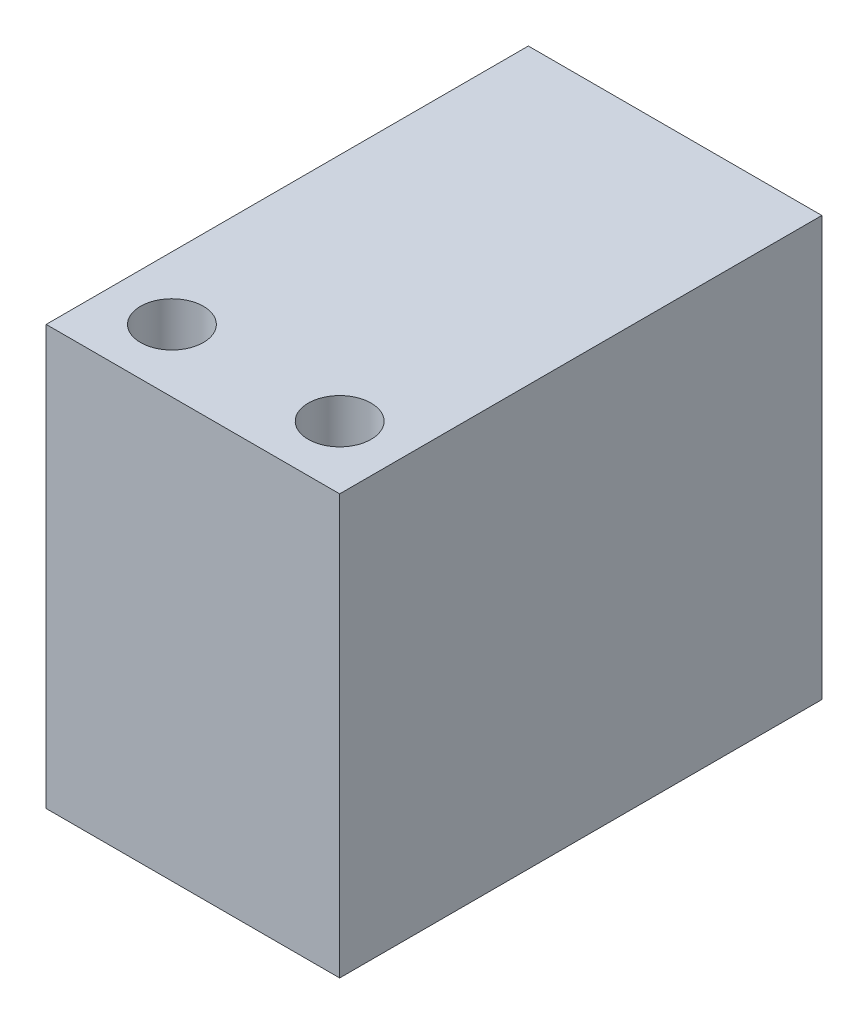
from build123d import *

# Parameters (mm, degrees)
SKETCH1_W                  = 14
SKETCH1_H                  = 23
BOSS_EXTRUDE1_DEPTH        = 20
F_3_0MM_DOWEL_HOLE1_D      = 3
F_3_0MM_DOWEL_HOLE1_DEPTH  = 5
F_3_0MM_DOWEL_HOLE1_TIP    = 0.901290929
M10X1_0_TAPPED_HOLE1_D     = 9
M10X1_0_TAPPED_HOLE1_DEPTH = 12
M10X1_0_TAPPED_HOLE1_TIP   = 2.703872786


with BuildPart() as part:
    # Sketch1 → Boss-Extrude1 (new body)
    with BuildSketch(Plane(origin=(0, 0, 0), x_dir=(1, 0, 0), z_dir=(0, 1, 0))):
        with Locations((7, 11.5)):
            Rectangle(SKETCH1_W, SKETCH1_H)
    extrude(amount=-BOSS_EXTRUDE1_DEPTH)

    # Ø3.0mm Dowel Hole1
    with Locations(Plane(origin=(0, 0, 0), x_dir=(1, 0, 0), z_dir=(0, 1, 0))):
        with Locations((3, 3), (11, 3)):
            Hole(F_3_0MM_DOWEL_HOLE1_D / 2, depth=F_3_0MM_DOWEL_HOLE1_DEPTH)
            with Locations((0, 0, -(F_3_0MM_DOWEL_HOLE1_DEPTH + F_3_0MM_DOWEL_HOLE1_TIP / 2))):  # 118° drill point
                Cone(0, F_3_0MM_DOWEL_HOLE1_D / 2, F_3_0MM_DOWEL_HOLE1_TIP, mode=Mode.SUBTRACT)

    # M10x1.0 Tapped Hole1
    with Locations(Plane(origin=(0, -20, 0), x_dir=(-1, 0, 0), z_dir=(0, -1, 0))):
        with Locations((-7, 15)):
            Hole(M10X1_0_TAPPED_HOLE1_D / 2, depth=M10X1_0_TAPPED_HOLE1_DEPTH)
            with Locations((0, 0, -(M10X1_0_TAPPED_HOLE1_DEPTH + M10X1_0_TAPPED_HOLE1_TIP / 2))):  # 118° drill point
                Cone(0, M10X1_0_TAPPED_HOLE1_D / 2, M10X1_0_TAPPED_HOLE1_TIP, mode=Mode.SUBTRACT)


solid = part.part
